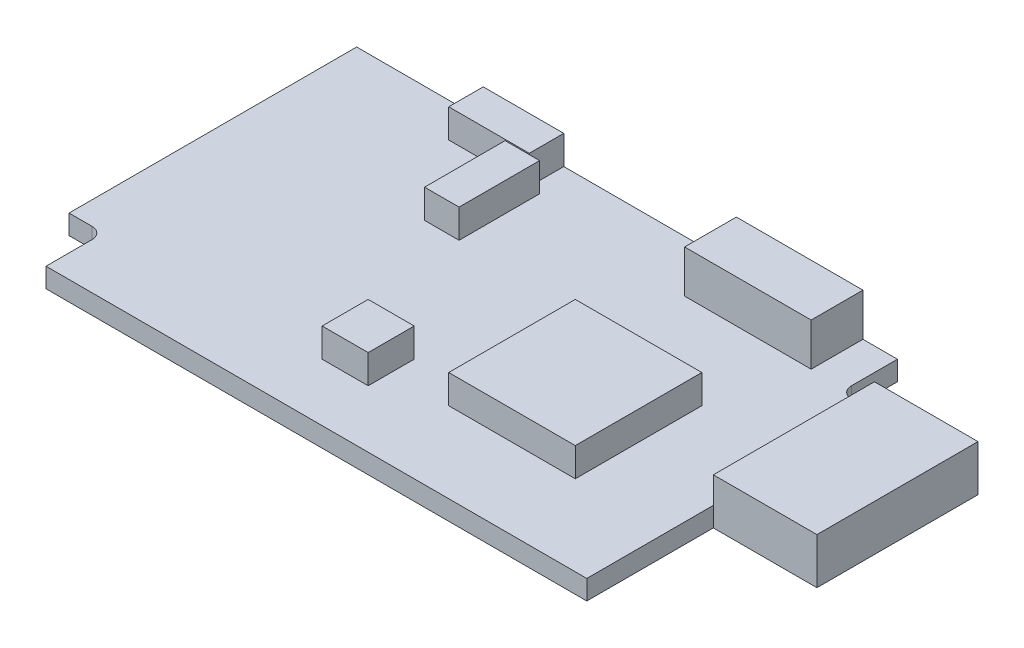
from build123d import *

# Parameters (mm, degrees)
BOSS_EXTRUDE2_DEPTH = 1.7
FILLET2_R           = 1
SKETCH2_W           = 7
SKETCH2_H           = 3
SKETCH2_W_2         = 3
SKETCH2_H_2         = 7
SKETCH2_W_3         = 4
SKETCH2_H_3         = 4
SKETCH2_W_4         = 11
SKETCH2_H_4         = 11
BOSS_EXTRUDE3_DEPTH = 2.5
SKETCH3_W           = 11
SKETCH3_H           = 4.5
BOSS_EXTRUDE4_DEPTH = 3.7
SKETCH4_W           = 14
SKETCH4_H           = 4
BOSS_EXTRUDE5_DEPTH = 9


with BuildPart() as part:
    # Sketch1 → Boss-Extrude2 (new body)
    with BuildSketch(Plane(origin=(0, 0, 0), x_dir=(1, 0, 0), z_dir=(0, 1, 0))):
        Polygon((0, 5), (3, 5), (3, 0), (50, 0), (50, 25), (47, 25), (47, 30), (0, 30), align=None)
    extrude(amount=BOSS_EXTRUDE2_DEPTH)

    # Fillet2
    fillet2_edges = [part.edges().sort_by_distance(p)[0] for p in [
        (47, 0.85, -25),
        (3, 0.85, -5),
    ]]
    fillet(fillet2_edges, radius=FILLET2_R)

    # Sketch2 → Boss-Extrude3 (add)
    with BuildSketch(Plane(origin=(0, 1.7, 0), x_dir=(1, 0, 0), z_dir=(0, 1, 0))):
        with Locations((14.5, 28.5)):
            Rectangle(SKETCH2_W, SKETCH2_H)
        with Locations((17.5, 23.4)):
            Rectangle(SKETCH2_W_2, SKETCH2_H_2)
        with Locations((24, 7)):
            Rectangle(SKETCH2_W_3, SKETCH2_H_3)
        with Locations((36.5, 12.5)):
            Rectangle(SKETCH2_W_4, SKETCH2_H_4)
    extrude(amount=BOSS_EXTRUDE3_DEPTH)

    # Sketch3 → Boss-Extrude4 (add)
    with BuildSketch(Plane(origin=(0, 1.7, -31.7), x_dir=(-1, 0, 0), z_dir=(0, 1, 0))):
        with Locations((-38.5, 3.95)):
            Rectangle(SKETCH3_W, SKETCH3_H)
    extrude(amount=BOSS_EXTRUDE4_DEPTH)

    # Sketch4 → Boss-Extrude5 (add)
    with BuildSketch(Plane(origin=(50, 0, 0), x_dir=(0, 0, -1), z_dir=(1, 0, 0))):
        with Locations((18, 2)):
            Rectangle(SKETCH4_W, SKETCH4_H)
    extrude(amount=BOSS_EXTRUDE5_DEPTH)


solid = part.part
